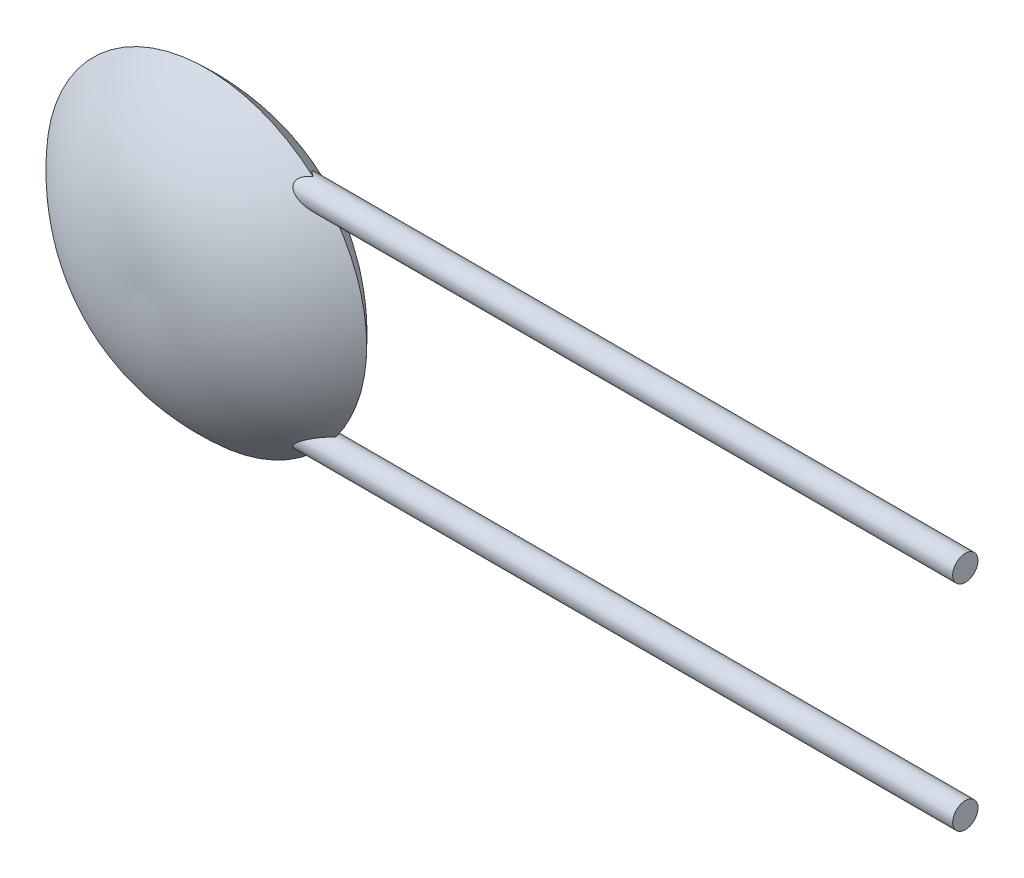
from build123d import *

# Parameters (mm, degrees)
SKETCH4_R = 0.15


with BuildPart() as part:
    # Sketch3 → Revolve1 (revolve)
    with BuildSketch(Plane(origin=(0, 0, 0), x_dir=(1, 0, 0), z_dir=(0, 1, 0))):
        with BuildLine():
            Line((1.9, 0), (0, 0))
            Line((0, 0), (0, -0.8))
            add(Edge.make_bspline(
                [(0, -0.8), (1.106882422, -0.865042619), (1.9, 0)],
                knots=[0, 0, 0, 1, 1, 1], degree=2))
        make_face()
        with BuildLine():
            Line((0, 0.8), (0, 0))
            Line((0, 0), (1.9, 0))
            add(Edge.make_bspline(
                [(0, 0.8), (1.106882422, 0.865042619), (1.9, 0)],
                knots=[0, 0, 0, 1, 1, 1], degree=2))
        make_face()
    revolve(axis=Axis((0, 0, 0.8), (0, 0, -1)))

    # Sweep1: sweep along a path in Sketch5
    with BuildLine(Plane(origin=(0, 1.27, 0), x_dir=(1, 0, 0), z_dir=(0, 1, 0))) as sweep1_path:
        Line((0, 0), (9, 0))
    # Sketch4 → Sweep1 (sweep)
    with BuildSketch(Plane(origin=(0, 0, 0), x_dir=(0, 0, -1), z_dir=(1, 0, 0))):
        with Locations((0, 1.27)):
            Circle(SKETCH4_R)
    sweep1 = sweep(path=sweep1_path.line)

    # Mirror1: Sweep1 across plane
    add(sweep1.mirror(Plane.ZX))


solid = part.part
